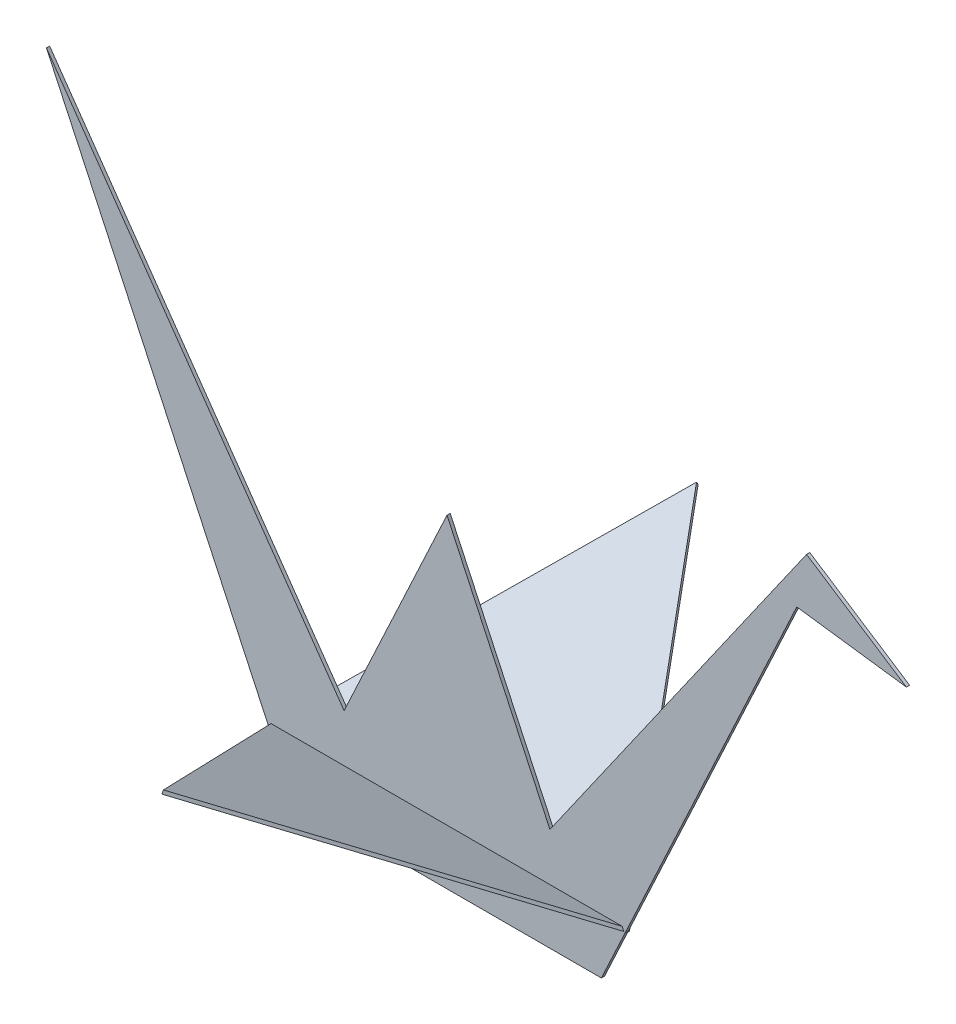
from build123d import *

# Parameters (mm, degrees)
BOSS_EXTRUDE1_DEPTH = 6.35
BOSS_EXTRUDE2_DEPTH = 3.175


with BuildPart() as part:
    # Sketch1 → Boss-Extrude1 (new body)
    with BuildSketch(Plane.XY):
        Polygon((-304.8, 0), (304.8, 0), (690.659261151, 827.477855881), (907.061590086, 798.54952059), (710.019622074, 927.013433042), (203.2, 203.2), (0, 638.963806248), (-203.2, 203.2), (-791.008562204, 1042.677626458), align=None)
    extrude(amount=BOSS_EXTRUDE1_DEPTH)

    # Sketch2 → Boss-Extrude2 (add, symmetric)
    with BuildSketch(Plane(origin=(0, 76.2, 43.994090512), x_dir=(1, 0, 0), z_dir=(0, 0.866025403784438, 0.500000000000001))):
        Polygon((-352.176858069, 50.8), (-40.026997385, 660.4), (352.176858069, 50.8), align=None)
    boss_extrude2 = extrude(amount=BOSS_EXTRUDE2_DEPTH, both=True)

    # Mirror1: Boss-Extrude2 across plane
    add(boss_extrude2.mirror(Plane.XY))


solid = part.part
